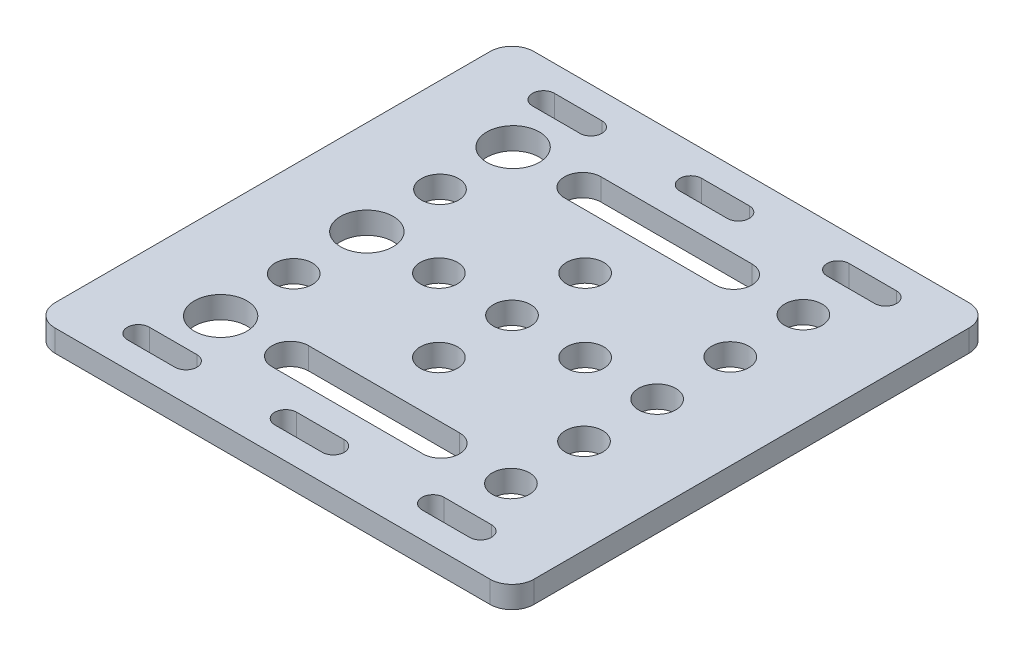
from build123d import *

# Parameters (mm, degrees)
SKETCH1_R           = 2.55
SKETCH1_R_2         = 3.6
BOSS_EXTRUDE1_DEPTH = 3


with BuildPart() as part:
    # Sketch1 → Boss-Extrude1 (new body)
    with BuildSketch(Plane.XZ):
        with BuildLine():
            Line((-32.75, 29.75), (-32.75, -29.75))
            ThreePointArc((-32.75, -29.75), (-31.871320344, -31.871320344), (-29.75, -32.75))
            Line((-29.75, -32.75), (29.75, -32.75))
            ThreePointArc((29.75, -32.75), (31.871320344, -31.871320344), (32.75, -29.75))
            Line((32.75, -29.75), (32.75, 29.75))
            ThreePointArc((32.75, 29.75), (31.871320344, 31.871320344), (29.75, 32.75))
            Line((29.75, 32.75), (-29.75, 32.75))
            ThreePointArc((-29.75, 32.75), (-31.871320344, 31.871320344), (-32.75, 29.75))
        make_face()
        with Locations(Location((0, -10, 0), (0, 0, 90))):
            Circle(SKETCH1_R, mode=Mode.SUBTRACT)
        with Locations(Location((-10, 0, 0), (0, 0, 90))):
            Circle(SKETCH1_R, mode=Mode.SUBTRACT)
        with Locations(Location((-19.85, 0, 0), (0, 0, 90))):
            Circle(SKETCH1_R_2, mode=Mode.SUBTRACT)
        with Locations(Location((-19.85, -10, 0), (0, 0, 90))):
            Circle(SKETCH1_R, mode=Mode.SUBTRACT)
        with Locations(Location((19.85, 0, 0), (0, 0, 90))):
            Circle(SKETCH1_R, mode=Mode.SUBTRACT)
        with Locations(Location((0, 10, 0), (0, 0, 90))):
            Circle(SKETCH1_R, mode=Mode.SUBTRACT)
        with Locations(Location((19.85, 10, 0), (0, 0, 90))):
            Circle(SKETCH1_R, mode=Mode.SUBTRACT)
        with Locations(Location((-19.85, 10, 0), (0, 0, 90))):
            Circle(SKETCH1_R, mode=Mode.SUBTRACT)
        with Locations(Location((19.85, -10, 0), (0, 0, 90))):
            Circle(SKETCH1_R, mode=Mode.SUBTRACT)
        with Locations(Location((19.85, 20, 0), (0, 0, 90))):
            Circle(SKETCH1_R, mode=Mode.SUBTRACT)
        with Locations(Location((19.85, -20, 0), (0, 0, 90))):
            Circle(SKETCH1_R, mode=Mode.SUBTRACT)
        with Locations(Location((-19.85, 20, 0), (0, 0, 90))):
            Circle(SKETCH1_R_2, mode=Mode.SUBTRACT)
        with Locations(Location((-19.85, -20, 0), (0, 0, 90))):
            Circle(SKETCH1_R_2, mode=Mode.SUBTRACT)
        with Locations(Location((10, 0, 0), (0, 0, 90))):
            Circle(SKETCH1_R, mode=Mode.SUBTRACT)
        with Locations(Location((0, 0, 0), (0, 0, 90))):
            Circle(SKETCH1_R, mode=Mode.SUBTRACT)
        with BuildLine():
            Line((-10.32, -17.5), (10.32, -17.5))
            ThreePointArc((10.32, -17.5), (12.82, -20), (10.32, -22.5))
            Line((10.32, -22.5), (-10.32, -22.5))
            ThreePointArc((-10.32, -22.5), (-12.82, -20), (-10.32, -17.5))
        make_face(mode=Mode.SUBTRACT)
        with BuildLine():
            Line((-23.4, -26.2), (-16.9, -26.2))
            ThreePointArc((-16.9, -26.2), (-15.4, -27.7), (-16.9, -29.2))
            Line((-16.9, -29.2), (-23.4, -29.2))
            ThreePointArc((-23.4, -29.2), (-24.9, -27.7), (-23.4, -26.2))
        make_face(mode=Mode.SUBTRACT)
        with BuildLine():
            Line((-10.32, 22.5), (10.32, 22.5))
            ThreePointArc((10.32, 22.5), (12.82, 20), (10.32, 17.5))
            Line((10.32, 17.5), (-10.32, 17.5))
            ThreePointArc((-10.32, 17.5), (-12.82, 20), (-10.32, 22.5))
        make_face(mode=Mode.SUBTRACT)
        with BuildLine():
            Line((-3.25, 29.2), (3.25, 29.2))
            ThreePointArc((3.25, 29.2), (4.75, 27.7), (3.25, 26.2))
            Line((3.25, 26.2), (-3.25, 26.2))
            ThreePointArc((-3.25, 26.2), (-4.75, 27.7), (-3.25, 29.2))
        make_face(mode=Mode.SUBTRACT)
        with BuildLine():
            Line((23.4, 26.2), (16.9, 26.2))
            ThreePointArc((16.9, 26.2), (15.4, 27.7), (16.9, 29.2))
            Line((16.9, 29.2), (23.4, 29.2))
            ThreePointArc((23.4, 29.2), (24.9, 27.7), (23.4, 26.2))
        make_face(mode=Mode.SUBTRACT)
        with BuildLine():
            Line((-23.4, 29.2), (-16.9, 29.2))
            ThreePointArc((-16.9, 29.2), (-15.4, 27.7), (-16.9, 26.2))
            Line((-16.9, 26.2), (-23.4, 26.2))
            ThreePointArc((-23.4, 26.2), (-24.9, 27.7), (-23.4, 29.2))
        make_face(mode=Mode.SUBTRACT)
        with BuildLine():
            Line((23.4, -29.2), (16.9, -29.2))
            ThreePointArc((16.9, -29.2), (15.4, -27.7), (16.9, -26.2))
            Line((16.9, -26.2), (23.4, -26.2))
            ThreePointArc((23.4, -26.2), (24.9, -27.7), (23.4, -29.2))
        make_face(mode=Mode.SUBTRACT)
        with BuildLine():
            Line((-3.25, -26.2), (3.25, -26.2))
            ThreePointArc((3.25, -26.2), (4.75, -27.7), (3.25, -29.2))
            Line((3.25, -29.2), (-3.25, -29.2))
            ThreePointArc((-3.25, -29.2), (-4.75, -27.7), (-3.25, -26.2))
        make_face(mode=Mode.SUBTRACT)
    extrude(amount=-BOSS_EXTRUDE1_DEPTH)


solid = part.part
